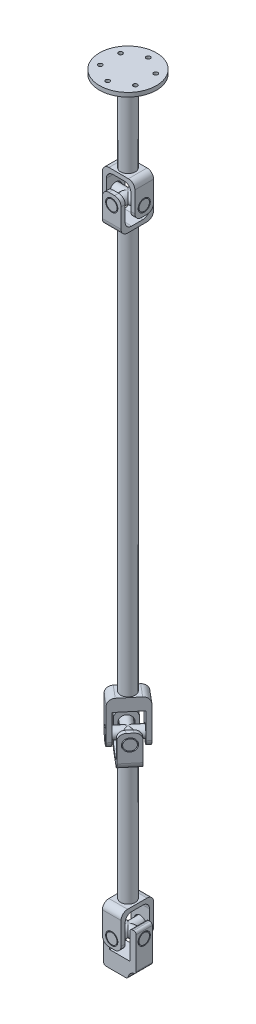
from build123d import *

# Parameters (mm, degrees)
SKETCH2_W            = 40
SKETCH2_H            = 20
BOSS_EXTRUDE1_DEPTH  = 55
SKETCH3_R            = 7.5
CUT_EXTRUDE1_DEPTH   = 69.738635424
SKETCH4_W            = 25
SKETCH4_H            = 35
CUT_EXTRUDE2_DEPTH   = 62.846584384
FILLET1_R            = 3
SKETCH23_R           = 5
CUT_EXTRUDE8_DEPTH   = 10
SKETCH5_R            = 6.5
BOSS_EXTRUDE2_DEPTH  = 40
SKETCH6_R            = 6.5
BOSS_EXTRUDE3_DEPTH  = 20
BOSS_EXTRUDE4_DEPTH  = 11.5
SKETCH12_R           = 7.5
CUT_EXTRUDE4_DEPTH   = 89.18163074
SKETCH8_R            = 9
BOSS_EXTRUDE5_DEPTH  = 150
BOSS_EXTRUDE6_DEPTH  = 5
BOSS_EXTRUDE7_DEPTH  = 35
SKETCH11_R           = 7.5
CUT_EXTRUDE3_DEPTH   = 271.91377435
FILLET2_R            = 8
SKETCH24_R           = 6.5
BOSS_EXTRUDE15_DEPTH = 40
SKETCH25_R           = 6.5
BOSS_EXTRUDE16_DEPTH = 20
BOSS_EXTRUDE8_DEPTH  = 10
SKETCH14_R           = 9
BOSS_EXTRUDE9_DEPTH  = 500
SKETCH15_W           = 23
SKETCH15_H           = 40
BOSS_EXTRUDE10_DEPTH = 5
SKETCH16_W           = 23
SKETCH16_H           = 5
BOSS_EXTRUDE11_DEPTH = 35
SKETCH17_R           = 7.5
CUT_EXTRUDE5_DEPTH   = 839.348279242
FILLET3_R            = 8
SKETCH21_R           = 7.5
CUT_EXTRUDE6_DEPTH   = 839.575155578
SKETCH26_R           = 6.5
BOSS_EXTRUDE17_DEPTH = 40
SKETCH27_R           = 6.5
BOSS_EXTRUDE18_DEPTH = 20
BOSS_EXTRUDE12_DEPTH = 11.5
SKETCH19_R           = 9
BOSS_EXTRUDE13_DEPTH = 100
FILLET4_R            = 8
SKETCH20_R           = 35
SKETCH20_R_2         = 2.5
BOSS_EXTRUDE14_DEPTH = 5
SKETCH22_R           = 7.5
CUT_EXTRUDE7_DEPTH   = 963.210995572


with BuildPart() as part:
    # Sketch2 → Boss-Extrude1 (new body)
    with BuildSketch(Plane(origin=(0, 0, 0), x_dir=(1, 0, 0), z_dir=(0, 1, 0))):
        Rectangle(SKETCH2_W, SKETCH2_H)
    extrude(amount=BOSS_EXTRUDE1_DEPTH)

    # Sketch3 → Cut-Extrude1 (cut, through all)
    with BuildSketch(Plane(origin=(20, 0, 0), x_dir=(0, 0, -1), z_dir=(1, 0, 0))):
        with Locations((0, 43)):
            Circle(SKETCH3_R)
    extrude(amount=-CUT_EXTRUDE1_DEPTH, mode=Mode.SUBTRACT)

    # Sketch4 → Cut-Extrude2 (cut, through all)
    with BuildSketch(Plane.XY.offset(10)):
        with Locations((0, 37.5)):
            Rectangle(SKETCH4_W, SKETCH4_H)
        with BuildLine():
            Line((20, 0), (20, 10))
            ThreePointArc((20, 10), (12.928932188, 7.071067812), (10, 0))
            Line((10, 0), (20, 0))
        make_face()
    extrude(amount=-CUT_EXTRUDE2_DEPTH, mode=Mode.SUBTRACT)

    # Fillet1
    fillet1_edges = [part.edges().sort_by_distance(p)[0] for p in [
        (20, 55, 0),
        (10, 0, 0),
        (20, 10, 0),
        (12.5, 55, 0),
        (-12.5, 55, 0),
        (-20, 55, 0),
        (-20, 0, 0),
    ]]
    fillet(fillet1_edges, radius=FILLET1_R)

    # Sketch23 → Cut-Extrude8 (cut)
    with BuildSketch(Plane.XZ):
        with Locations(Location((-4.82455532, 0, 0), (0, 0, 270))):
            Circle(SKETCH23_R)
    extrude(amount=-CUT_EXTRUDE8_DEPTH, mode=Mode.SUBTRACT)


with BuildPart() as body_2:
    # Sketch5 → Boss-Extrude2 (new body)
    with BuildSketch(Plane.ZY.offset(20)):
        with Locations((0, 43)):
            Circle(SKETCH5_R)
    extrude(amount=-BOSS_EXTRUDE2_DEPTH)

    # Sketch6 → Boss-Extrude3 (add, symmetric)
    with BuildSketch(Plane.XY):
        with Locations(Location((0, 43, 0), (0, 0, 180))):
            Circle(SKETCH6_R)
    extrude(amount=BOSS_EXTRUDE3_DEPTH, both=True)


with BuildPart() as body_3:
    # Sketch7 → Boss-Extrude4 (new, symmetric)
    with BuildSketch(Plane(origin=(0, 0, 0), x_dir=(0, 0, -1), z_dir=(1, 0, 0))):
        Polygon((-20, 32.5), (-15, 32.5), (-15, 71), (15, 71), (15, 32.5), (20, 32.5), (20, 76), (-20, 76), align=None)
    extrude(amount=BOSS_EXTRUDE4_DEPTH, both=True)

    # Sketch12 → Cut-Extrude4 (cut, through all)
    with BuildSketch(Plane(origin=(0, 0, -20), x_dir=(-1, 0, 0), z_dir=(0, 0, -1))):
        with Locations((0, 43)):
            Circle(SKETCH12_R)
    extrude(amount=-CUT_EXTRUDE4_DEPTH, mode=Mode.SUBTRACT)

    # Sketch8 → Boss-Extrude5 (add)
    with BuildSketch(Plane(origin=(0, 76, 0), x_dir=(1, 0, 0), z_dir=(0, 1, 0))):
        with Locations(Location((0, 0, 0), (0, 0, 270))):
            Circle(SKETCH8_R)
    extrude(amount=BOSS_EXTRUDE5_DEPTH)

    # Sketch9 → Boss-Extrude6 (add)
    with BuildSketch(Plane(origin=(0, 226, 0), x_dir=(1, 0, 0), z_dir=(0, 1, 0))):
        Polygon((-7.928831351, 21.66526329), (-22.712946374, 4.046241098), (7.928831351, -21.66526329), (22.712946374, -4.046241098), align=None)
    extrude(amount=BOSS_EXTRUDE6_DEPTH)

    # Sketch10 → Boss-Extrude7 (add)
    with BuildSketch(Plane(origin=(0, 231, 0), x_dir=(1, 0, 0), z_dir=(0, 1, 0))):
        Polygon((7.928831351, -21.66526329), (22.712946374, -4.046241098), (18.882724158, -0.832303049), (4.098609135, -18.451325241), align=None)
        Polygon((-7.928831351, 21.66526329), (-22.712946374, 4.046241098), (-18.882724158, 0.832303049), (-4.098609135, 18.451325241), align=None)
    extrude(amount=BOSS_EXTRUDE7_DEPTH)

    # Sketch11 → Cut-Extrude3 (cut, through all)
    with BuildSketch(Plane(origin=(15.320888862, 0, 12.855752194), x_dir=(0.6427876096865404, 0, -0.7660444431189771), z_dir=(0.7660444431189771, 0, 0.6427876096865404))):
        with Locations((0, 253.5)):
            Circle(SKETCH11_R)
    extrude(amount=-CUT_EXTRUDE3_DEPTH, mode=Mode.SUBTRACT)

    # Fillet2
    fillet2_edges = [body_3.edges().sort_by_distance(p)[0] for p in [
        (-11.5, 32.5, 17.5),
        (0, 76, 20),
        (0, 76, -20),
        (0, 71, -15),
        (0, 71, 15),
        (11.5, 32.5, -17.5),
        (15.320888862, 226, 12.855752194),
        (-15.320888862, 226, -12.855752194),
        (11.490666647, 231, 9.641814145),
        (6.013720243, 266, 20.058294265),
        (20.797835266, 266, 2.439272074),
        (-11.490666647, 231, -9.641814145),
        (-6.013720243, 266, -20.058294265),
        (-20.797835266, 266, -2.439272074),
        (11.5, 32.5, 17.5),
        (-11.5, 32.5, -17.5),
    ]]
    fillet(fillet2_edges, radius=FILLET2_R)


with BuildPart() as body_4:
    # Sketch24 → Boss-Extrude15 (new body)
    with BuildSketch(Plane(origin=(15.320888862, 0, 12.855752194), x_dir=(0.6427876096865404, 0, -0.7660444431189771), z_dir=(0.7660444431189771, 0, 0.6427876096865404))):
        with Locations((0, 253.5)):
            Circle(SKETCH24_R)
    extrude(amount=-BOSS_EXTRUDE15_DEPTH)

    # Sketch25 → Boss-Extrude16 (add, symmetric)
    with BuildSketch(Plane(origin=(0, 0, 0), x_dir=(0.7660444431189773, 0, 0.6427876096865401), z_dir=(-0.6427876096865401, 0, 0.7660444431189773))):
        with Locations(Location((0, 253.5, 0), (0, 0, 90))):
            Circle(SKETCH25_R)
    extrude(amount=BOSS_EXTRUDE16_DEPTH, both=True)


with BuildPart() as body_5:
    # Sketch13 → Boss-Extrude8 (new, symmetric)
    with BuildSketch(Plane(origin=(0, 0, 0), x_dir=(-0.6427876096865403, 0, 0.7660444431189773), z_dir=(-0.7660444431189773, 0, -0.6427876096865403))):
        Polygon((-15, 242), (-15, 282), (15, 282), (15, 242), (20, 242), (20, 297), (-20, 297), (-20, 242), align=None)
    extrude(amount=BOSS_EXTRUDE8_DEPTH, both=True)

    # Sketch14 → Boss-Extrude9 (add)
    with BuildSketch(Plane(origin=(0, 297, 0), x_dir=(1, 0, 0), z_dir=(0, 1, 0))):
        with Locations(Location((0, 0, 0), (0, 0, 270))):
            Circle(SKETCH14_R)
    extrude(amount=BOSS_EXTRUDE9_DEPTH)

    # Sketch15 → Boss-Extrude10 (add)
    with BuildSketch(Plane(origin=(0, 797, 0), x_dir=(1, 0, 0), z_dir=(0, 1, 0))):
        Rectangle(SKETCH15_W, SKETCH15_H)
    extrude(amount=BOSS_EXTRUDE10_DEPTH)

    # Sketch16 → Boss-Extrude11 (add)
    with BuildSketch(Plane(origin=(0, 802, 0), x_dir=(1, 0, 0), z_dir=(0, 1, 0))):
        with Locations((0, 17.5)):
            Rectangle(SKETCH16_W, SKETCH16_H)
        with Locations((0, -17.5)):
            Rectangle(SKETCH16_W, SKETCH16_H)
    extrude(amount=BOSS_EXTRUDE11_DEPTH)

    # Sketch17 → Cut-Extrude5 (cut, through all)
    with BuildSketch(Plane.XY.offset(20)):
        with Locations((0, 825)):
            Circle(SKETCH17_R)
    extrude(amount=-CUT_EXTRUDE5_DEPTH, mode=Mode.SUBTRACT)

    # Fillet3
    fillet3_edges = [body_5.edges().sort_by_distance(p)[0] for p in [
        (18.909227601, 242, -6.977901658),
        (12.855752194, 297, -15.320888862),
        (-12.855752194, 297, 15.320888862),
        (-18.909227601, 242, 6.977901658),
        (0, 797, 20),
        (0, 797, -20),
        (0, 802, -15),
        (-11.5, 837, -17.5),
        (11.5, 837, -17.5),
        (0, 802, 15),
        (11.5, 837, 17.5),
        (-11.5, 837, 17.5),
        (3.588338738, 242, -19.833653851),
        (-3.588338738, 242, 19.833653851),
    ]]
    fillet(fillet3_edges, radius=FILLET3_R)

    # Sketch21 → Cut-Extrude6 (cut, through all)
    with BuildSketch(Plane(origin=(-12.855752194, 0, 15.320888862), x_dir=(0.7660444431189772, 0, 0.6427876096865404), z_dir=(-0.6427876096865403, 0, 0.7660444431189771))):
        with Locations((0, 253.5)):
            Circle(SKETCH21_R)
    extrude(amount=-CUT_EXTRUDE6_DEPTH, mode=Mode.SUBTRACT)


with BuildPart() as body_6:
    # Sketch26 → Boss-Extrude17 (new body)
    with BuildSketch(Plane.XY.offset(20)):
        with Locations((0, 825)):
            Circle(SKETCH26_R)
    extrude(amount=-BOSS_EXTRUDE17_DEPTH)

    # Sketch27 → Boss-Extrude18 (add, symmetric)
    with BuildSketch(Plane.ZY):
        with Locations(Location((0, 825, 0), (0, 0, 90))):
            Circle(SKETCH27_R)
    extrude(amount=BOSS_EXTRUDE18_DEPTH, both=True)


with BuildPart() as body_7:
    # Sketch18 → Boss-Extrude12 (new, symmetric)
    with BuildSketch(Plane(origin=(0, 0, 0), x_dir=(-1, 0, 0), z_dir=(0, 0, -1))):
        Polygon((-15, 813.5), (-15, 850), (15, 850), (15, 813.5), (20, 813.5), (20, 855), (-20, 855), (-20, 813.5), align=None)
    extrude(amount=BOSS_EXTRUDE12_DEPTH, both=True)

    # Sketch19 → Boss-Extrude13 (add)
    with BuildSketch(Plane(origin=(0, 855, 0), x_dir=(1, 0, 0), z_dir=(0, 1, 0))):
        with Locations(Location((0, 0, 0), (0, 0, 270))):
            Circle(SKETCH19_R)
    extrude(amount=BOSS_EXTRUDE13_DEPTH)

    # Fillet4
    fillet4_edges = [body_7.edges().sort_by_distance(p)[0] for p in [
        (17.5, 813.5, 11.5),
        (20, 855, 0),
        (-20, 855, 0),
        (-15, 850, 0),
        (15, 850, 0),
        (-17.5, 813.5, -11.5),
        (17.5, 813.5, -11.5),
        (-17.5, 813.5, 11.5),
    ]]
    fillet(fillet4_edges, radius=FILLET4_R)

    # Sketch20 → Boss-Extrude14 (add)
    with BuildSketch(Plane(origin=(0, 955, 0), x_dir=(1, 0, 0), z_dir=(0, 1, 0))):
        with Locations(Location((0, 0, 0), (0, 0, 270))):
            Circle(SKETCH20_R)
        with Locations(Location((0, 25, 0), (0, 0, 270))):
            Circle(SKETCH20_R_2, mode=Mode.SUBTRACT)
        with Locations(Location((21.650635095, 12.5, 0), (0, 0, 270))):
            Circle(SKETCH20_R_2, mode=Mode.SUBTRACT)
        with Locations(Location((21.650635095, -12.5, 0), (0, 0, 270))):
            Circle(SKETCH20_R_2, mode=Mode.SUBTRACT)
        with Locations(Location((0, -25, 0), (0, 0, 270))):
            Circle(SKETCH20_R_2, mode=Mode.SUBTRACT)
        with Locations(Location((-21.650635095, -12.5, 0), (0, 0, 270))):
            Circle(SKETCH20_R_2, mode=Mode.SUBTRACT)
        with Locations(Location((-21.650635095, 12.5, 0), (0, 0, 270))):
            Circle(SKETCH20_R_2, mode=Mode.SUBTRACT)
    extrude(amount=BOSS_EXTRUDE14_DEPTH)

    # Sketch22 → Cut-Extrude7 (cut, through all)
    with BuildSketch(Plane.ZY.offset(20)):
        with Locations((0, 825)):
            Circle(SKETCH22_R)
    extrude(amount=-CUT_EXTRUDE7_DEPTH, mode=Mode.SUBTRACT)


solid = Compound([part.part, body_2.part, body_3.part, body_4.part, body_5.part, body_6.part, body_7.part])
